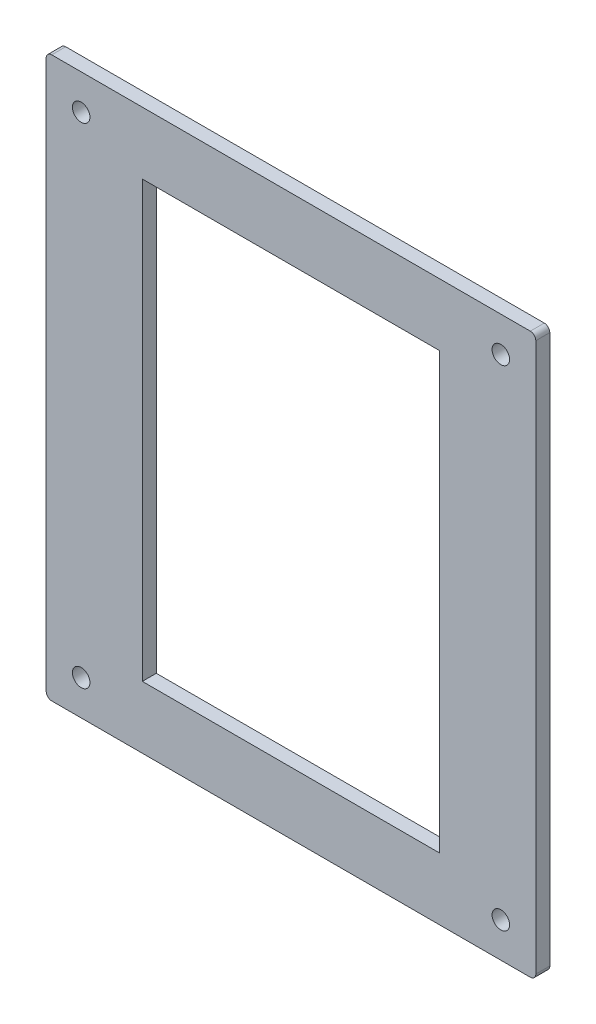
from build123d import *

# Parameters (mm, degrees)
SKETCH1_W           = 88.9
SKETCH1_H           = 101.6
SKETCH1_R           = 1.59
SKETCH1_W_2         = 54
SKETCH1_H_2         = 79
BOSS_EXTRUDE1_DEPTH = 2.54
FILLET1_R           = 1


with BuildPart() as part:
    # Sketch1 → Boss-Extrude1 (new body)
    with BuildSketch(Plane.XY):
        with Locations((44.45, -50.8)):
            Rectangle(SKETCH1_W, SKETCH1_H)
        with Locations((6.35, -6.35)):
            Circle(SKETCH1_R, mode=Mode.SUBTRACT)
        with Locations((82.55, -6.35)):
            Circle(SKETCH1_R, mode=Mode.SUBTRACT)
        with Locations((82.55, -95.25)):
            Circle(SKETCH1_R, mode=Mode.SUBTRACT)
        with Locations((6.35, -95.25)):
            Circle(SKETCH1_R, mode=Mode.SUBTRACT)
        with Locations((44.45, -50.8)):
            Rectangle(SKETCH1_W_2, SKETCH1_H_2, mode=Mode.SUBTRACT)
    extrude(amount=BOSS_EXTRUDE1_DEPTH)

    # Fillet1
    fillet1_edges = [part.edges().sort_by_distance(p)[0] for p in [
        (0, 0, 1.27),
        (88.9, 0, 1.27),
        (88.9, -101.6, 1.27),
        (0, -101.6, 1.27),
    ]]
    fillet(fillet1_edges, radius=FILLET1_R)


solid = part.part
